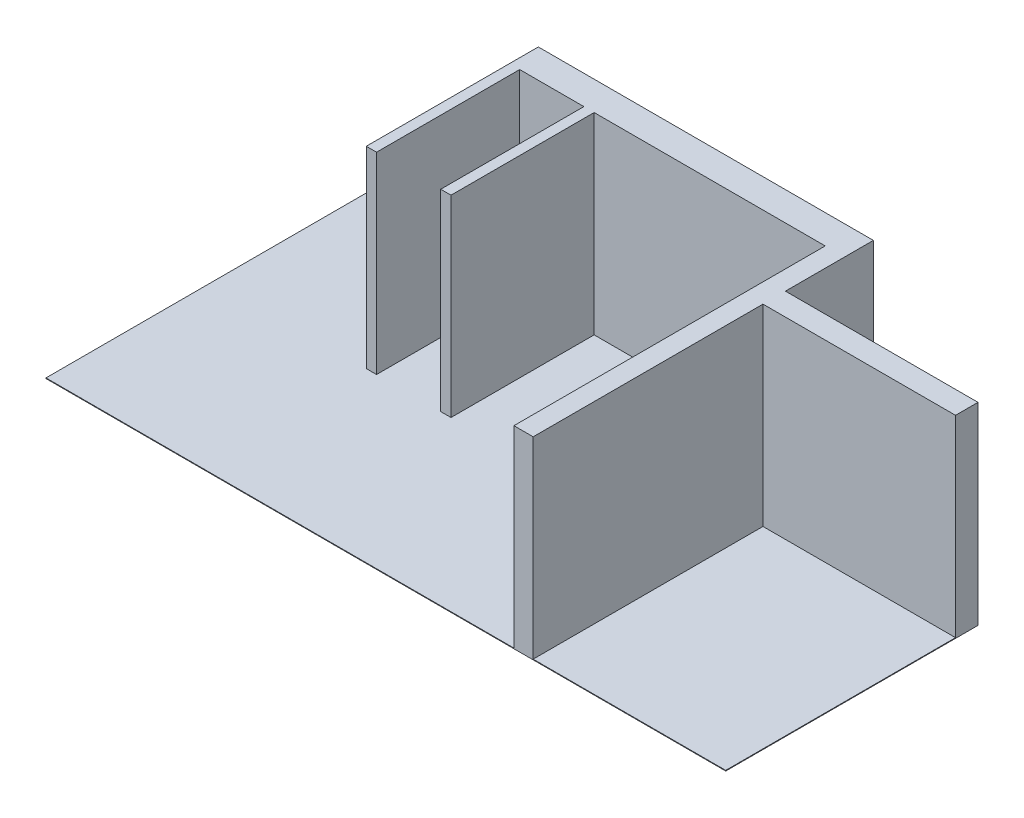
from build123d import *

# Parameters (mm, degrees)
DODANIE_WYCI_GNI_CIE1_DEPTH = 3000
DODANIE_WYCI_GNI_CIE5_DEPTH = 10
DODANIE_WYCI_GNI_CIE6_DEPTH = 10


with BuildPart() as part:
    # Szkic1 → Dodanie-wyciągnięcie1 (new body)
    with BuildSketch(Plane(origin=(0, 0, 0), x_dir=(1, 0, 0), z_dir=(0, 1, 0))):
        Polygon((-1800, 0), (1800, 0), (1800, -4850), (2100, -4850), (2100, -1270), (5100, -1270), (5100, -920), (2100, -920), (2100, 450), (-3120, 450), (-3120, -2230), (-2960, -2230), (-2960, 0), (-1960, 0), (-1960, -2230), (-1800, -2230), align=None)
    extrude(amount=DODANIE_WYCI_GNI_CIE1_DEPTH)

    # Szkic3 → Dodanie-wyciągnięcie5 (add)
    with BuildSketch(Plane.XZ):
        Polygon((-3120, -450), (-5489.748639645, -450), (-5489.748639645, 4850), (1800, 4850), (1950, 4850), (1950, -450), (1800, -450), align=None)
    extrude(amount=DODANIE_WYCI_GNI_CIE5_DEPTH)

    # Szkic4 → Dodanie-wyciągnięcie6 (add)
    with BuildSketch(Plane.XZ):
        Polygon((1950, -450), (2100, -450), (2100, 920), (5100, 920), (5100, 4850), (1950, 4850), align=None)
    extrude(amount=DODANIE_WYCI_GNI_CIE6_DEPTH)


solid = part.part
